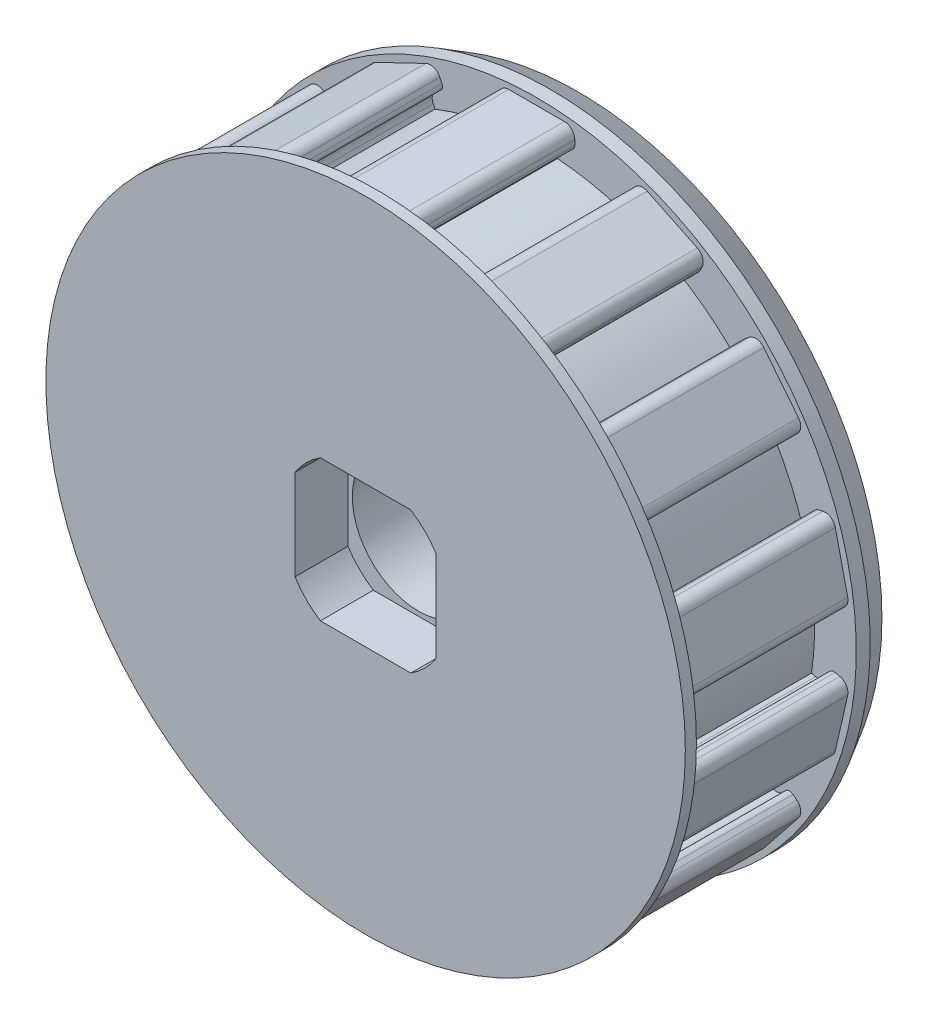
from build123d import *

# Parameters (mm, degrees)
SKETCH1_R           = 40
SKETCH1_R_2         = 9.525
BOSS_EXTRUDE1_DEPTH = 23
BOSS_EXTRUDE2_DEPTH = 23
CIRPATTERN1_COUNT   = 14
CUT_EXTRUDE2_DEPTH  = 6.02
BOSS_EXTRUDE3_START = 1.6
SKETCH8_R           = 46
BOSS_EXTRUDE3_DEPTH = 1.6
SKETCH13_R          = 46
BOSS_EXTRUDE7_DEPTH = 6
SKETCH11_R          = 27
CUT_EXTRUDE4_DEPTH  = 13
CHAMFER1_SIZE       = 7.5
CHAMFER1_SIZE2      = 12.990381057
CHAMFER2_SIZE       = 4
CHAMFER2_SIZE2      = 2.309401077
SKETCH14_R          = 14.5
CUT_EXTRUDE5_DEPTH  = 1


with BuildPart() as part:
    # Sketch1 → Boss-Extrude1 (new body)
    with BuildSketch(Plane.XY):
        Circle(SKETCH1_R)
        Circle(SKETCH1_R_2, mode=Mode.SUBTRACT)
    extrude(amount=BOSS_EXTRUDE1_DEPTH)

    # Sketch3 → Boss-Extrude2 (add)
    with BuildSketch(Plane(origin=(0, 0, 0), x_dir=(-1, 0, 0), z_dir=(0, 0, -1))):
        with BuildLine():
            Line((-4, 45), (4, 45))
            ThreePointArc((4, 45), (5.060660172, 44.560660172), (5.5, 43.5))
            Line((5.5, 43.5), (5.5, 42.8))
            ThreePointArc((5.5, 42.8), (5.265685425, 42.234314575), (4.7, 42))
            Line((4.7, 42), (4.5, 42))
            ThreePointArc((4.5, 42), (3.439339828, 41.560660172), (3, 40.5))
            Line((3, 40.5), (3, 35.939344152))
            Line((3, 35.939344152), (-3, 35.939344152))
            Line((-3, 35.939344152), (-3, 40.5))
            ThreePointArc((-3, 40.5), (-3.439339828, 41.560660172), (-4.5, 42))
            Line((-4.5, 42), (-4.7, 42))
            ThreePointArc((-4.7, 42), (-5.265685425, 42.234314575), (-5.5, 42.8))
            Line((-5.5, 42.8), (-5.5, 43.5))
            ThreePointArc((-5.5, 43.5), (-5.060660172, 44.560660172), (-4, 45))
        make_face()
    boss_extrude2 = extrude(amount=-BOSS_EXTRUDE2_DEPTH)

    # CirPattern1: Boss-Extrude2 ×14 about axis
    cirpattern1_axis = Axis((0, 0, 0), (0, 0, 1))
    for i in range(1, CIRPATTERN1_COUNT):
        add(boss_extrude2.rotate(cirpattern1_axis, i * 360 / CIRPATTERN1_COUNT))

    # Sketch2 → Cut-Extrude2 (cut)
    with BuildSketch(Plane.XY.offset(23)):
        with BuildLine():
            ThreePointArc((-10.16, -6.506813736), (-8.531243315, -8.531243315), (-6.506813736, -10.16))
            Line((-6.506813736, -10.16), (6.506813736, -10.16))
            ThreePointArc((6.506813736, -10.16), (8.531243315, -8.531243315), (10.16, -6.506813736))
            Line((10.16, -6.506813736), (10.16, 6.506813736))
            ThreePointArc((10.16, 6.506813736), (8.531243315, 8.531243315), (6.506813736, 10.16))
            Line((6.506813736, 10.16), (-6.506813736, 10.16))
            ThreePointArc((-6.506813736, 10.16), (-8.531243315, 8.531243315), (-10.16, 6.506813736))
            Line((-10.16, 6.506813736), (-10.16, -6.506813736))
        make_face()
    extrude(amount=-CUT_EXTRUDE2_DEPTH, mode=Mode.SUBTRACT)

    # Sketch8 → Boss-Extrude3 (add)
    with BuildSketch(Plane.XY.offset(23).offset(BOSS_EXTRUDE3_START)):
        Circle(SKETCH8_R)
        with BuildLine():
            Line((10.16, -6.506813736), (10.16, 6.506813736))
            ThreePointArc((10.16, 6.506813736), (8.531243315, 8.531243315), (6.506813736, 10.16))
            Line((6.506813736, 10.16), (-6.506813736, 10.16))
            ThreePointArc((-6.506813736, 10.16), (-8.531243315, 8.531243315), (-10.16, 6.506813736))
            Line((-10.16, 6.506813736), (-10.16, -6.506813736))
            ThreePointArc((-10.16, -6.506813736), (-8.531243315, -8.531243315), (-6.506813736, -10.16))
            Line((-6.506813736, -10.16), (6.506813736, -10.16))
            ThreePointArc((6.506813736, -10.16), (8.531243315, -8.531243315), (10.16, -6.506813736))
        make_face(mode=Mode.SUBTRACT)
    extrude(amount=-BOSS_EXTRUDE3_DEPTH)

    # Sketch13 → Boss-Extrude7 (add)
    with BuildSketch(Plane(origin=(0, 0, 0), x_dir=(-1, 0, 0), z_dir=(0, 0, -1))):
        with Locations(Location((0, 0, 0), (0, 0, 180))):
            Circle(SKETCH13_R)
    extrude(amount=BOSS_EXTRUDE7_DEPTH)

    # Sketch11 → Cut-Extrude4 (cut)
    with BuildSketch(Plane(origin=(0, 0, -6), x_dir=(-1, 0, 0), z_dir=(0, 0, -1))):
        Circle(SKETCH11_R)
    extrude(amount=-CUT_EXTRUDE4_DEPTH, mode=Mode.SUBTRACT)

    # Chamfer1
    chamfer1_edges = [part.edges().sort_by_distance(p)[0] for p in [
        (27, 0, -6),
    ]]
    chamfer1_side = [part.faces().sort_by_distance(p)[0] for p in [
        (-44.698923523, 0, -6),
    ]]
    chamfer(chamfer1_edges, length=CHAMFER1_SIZE, length2=CHAMFER1_SIZE2, reference=chamfer1_side[0])

    # Chamfer2
    chamfer2_edges = [part.edges().sort_by_distance(p)[0] for p in [
        (-46, 0, -6),
    ]]
    chamfer2_side = [part.faces().sort_by_distance(p)[0] for p in [
        (-46, 0, -3),
    ]]
    chamfer(chamfer2_edges, length=CHAMFER2_SIZE, length2=CHAMFER2_SIZE2, reference=chamfer2_side[0])

    # Sketch14 → Cut-Extrude5 (cut)
    with BuildSketch(Plane(origin=(0, 0, 7), x_dir=(-1, 0, 0), z_dir=(0, 0, -1))):
        Circle(SKETCH14_R)
    extrude(amount=-CUT_EXTRUDE5_DEPTH, mode=Mode.SUBTRACT)


solid = part.part
